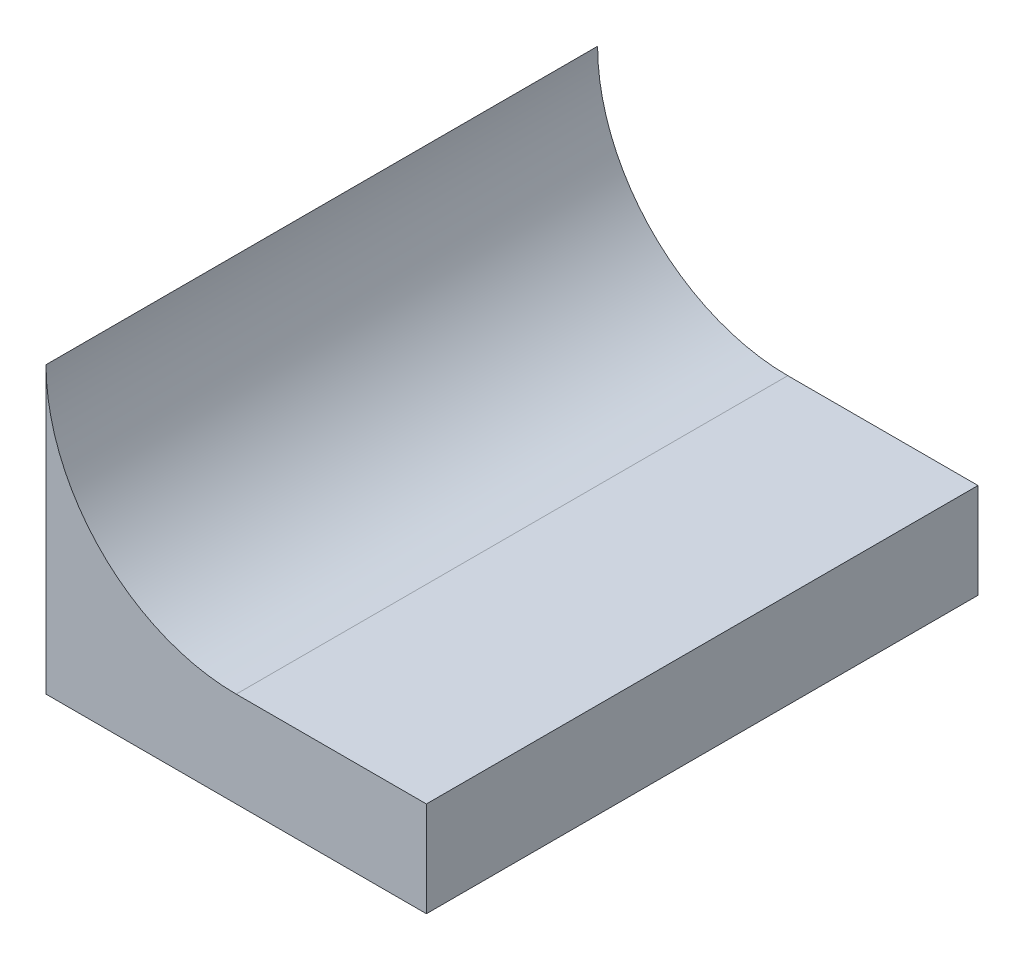
from build123d import *

# Parameters (mm, degrees)
BOSS_EXTRUDE1_DEPTH = 0.29


with BuildPart() as part:
    # Sketch1 → Boss-Extrude1 (new, symmetric)
    with BuildSketch(Plane.XY):
        with BuildLine():
            Line((0, 0), (0.4, 0))
            Line((0.4, 0), (0.4, 0.1))
            Line((0.4, 0.1), (0.2, 0.1))
            ThreePointArc((0.2, 0.1), (0.058578644, 0.158578644), (0, 0.3))
            Line((0, 0.3), (0, 0))
        make_face()
    extrude(amount=BOSS_EXTRUDE1_DEPTH, both=True)


solid = part.part
